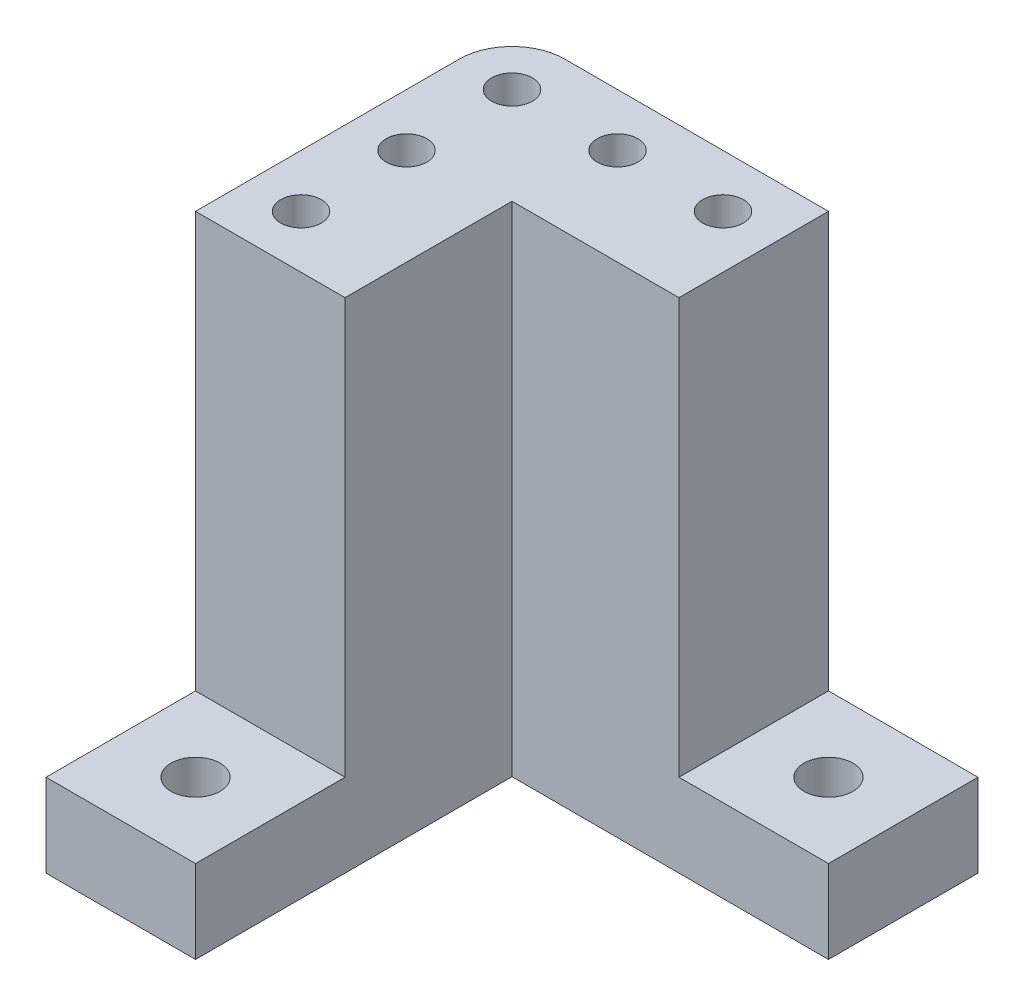
from build123d import *

# Parameters (mm, degrees)
BOSS_EXTRUDE1_DEPTH = 60
SKETCH2_R           = 2.45
CUT_EXTRUDE1_DEPTH  = 81.642544603
CUT_EXTRUDE2_DEPTH  = 81.642544603
SKETCH4_W           = 18
SKETCH4_H           = 18
SKETCH4_R           = 2.95
BOSS_EXTRUDE2_DEPTH = 10


with BuildPart() as part:
    # Sketch1 → Boss-Extrude1 (new body)
    with BuildSketch(Plane(origin=(0, 0, 0), x_dir=(1, 0, 0), z_dir=(0, 1, 0))):
        Polygon((0, 0), (38.1, 0), (38.1, -18), (18, -18), (18, -38.1), (0, -38.1), align=None)
    extrude(amount=BOSS_EXTRUDE1_DEPTH)

    # Sketch2 → Cut-Extrude1 (cut, through all)
    with BuildSketch(Plane(origin=(0, 60, 0), x_dir=(1, 0, 0), z_dir=(0, 1, 0))):
        with Locations(Location((6.35, -6.35, 0), (0, 0, 270))):
            Circle(SKETCH2_R)
        with Locations(Location((6.35, -19.05, 0), (0, 0, 270))):
            Circle(SKETCH2_R)
        with Locations(Location((6.35, -31.75, 0), (0, 0, 270))):
            Circle(SKETCH2_R)
        with Locations(Location((19.05, -6.35, 0), (0, 0, 270))):
            Circle(SKETCH2_R)
        with Locations(Location((31.75, -6.35, 0), (0, 0, 270))):
            Circle(SKETCH2_R)
    extrude(amount=-CUT_EXTRUDE1_DEPTH, mode=Mode.SUBTRACT)

    # Sketch3 → Cut-Extrude2 (cut, through all)
    with BuildSketch(Plane(origin=(0, 60, 0), x_dir=(1, 0, 0), z_dir=(0, 1, 0))):
        with BuildLine():
            Line((0, -6.35), (-3.023343313, -6.35))
            Line((-3.023343313, -6.35), (-3.023343313, 2.931868043))
            Line((-3.023343313, 2.931868043), (6.35, 2.931868043))
            Line((6.35, 2.931868043), (6.35, 0))
            ThreePointArc((6.35, 0), (1.859871939, -1.859871939), (0, -6.35))
        make_face()
    extrude(amount=-CUT_EXTRUDE2_DEPTH, mode=Mode.SUBTRACT)

    # Sketch4 → Boss-Extrude2 (add)
    # profile 1 of 2: a face of its own
    with BuildSketch(Plane(origin=(0, 0, 0), x_dir=(-1, 0, 0), z_dir=(0, -1, 0))):
        with Locations((-9, -47.1)):
            Rectangle(SKETCH4_W, SKETCH4_H)
        with Locations(Location((-9, -47.1, 0), (0, 0, 90))):
            Circle(SKETCH4_R, mode=Mode.SUBTRACT)
    # profile 2 of 2: a face of its own
    with BuildSketch(Plane(origin=(0, 0, 0), x_dir=(-1, 0, 0), z_dir=(0, -1, 0))):
        with Locations((-47.1, -9)):
            Rectangle(SKETCH4_W, SKETCH4_H)
        with Locations(Location((-47.1, -9, 0), (0, 0, 90))):
            Circle(SKETCH4_R, mode=Mode.SUBTRACT)
    extrude(amount=-BOSS_EXTRUDE2_DEPTH)


solid = part.part
